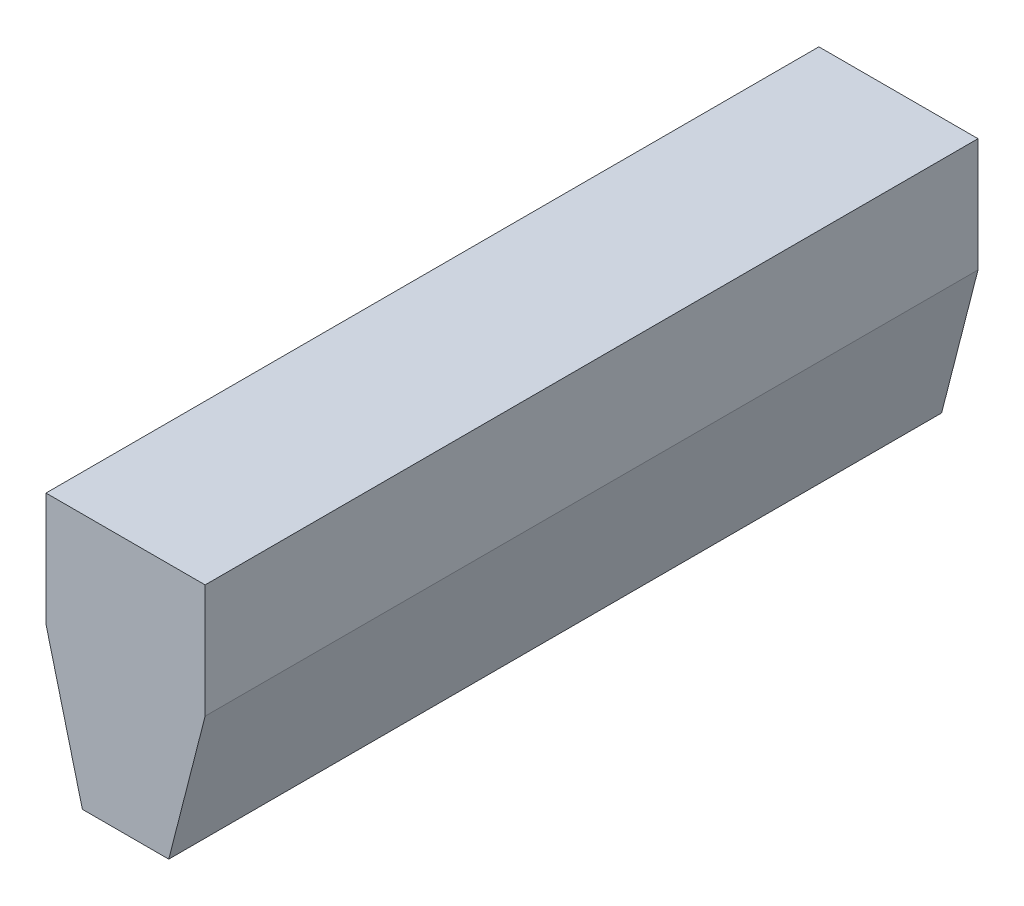
from build123d import *

# Parameters (mm, degrees)
KAP_PC_GOVDE_5MM_1_START = -20
KAP_PC_GOVDE_5MM_1_DEPTH = 680


with BuildPart() as part:
    # Sketch1 → KAP_PC_govde_5mm_1 (new body)
    with BuildSketch(Plane.XY.offset(KAP_PC_GOVDE_5MM_1_START)):
        Polygon((-70, 255), (70, 255), (70, 155), (38, 30), (-38, 30), (-70, 155), align=None)
    extrude(amount=-KAP_PC_GOVDE_5MM_1_DEPTH)


solid = part.part
